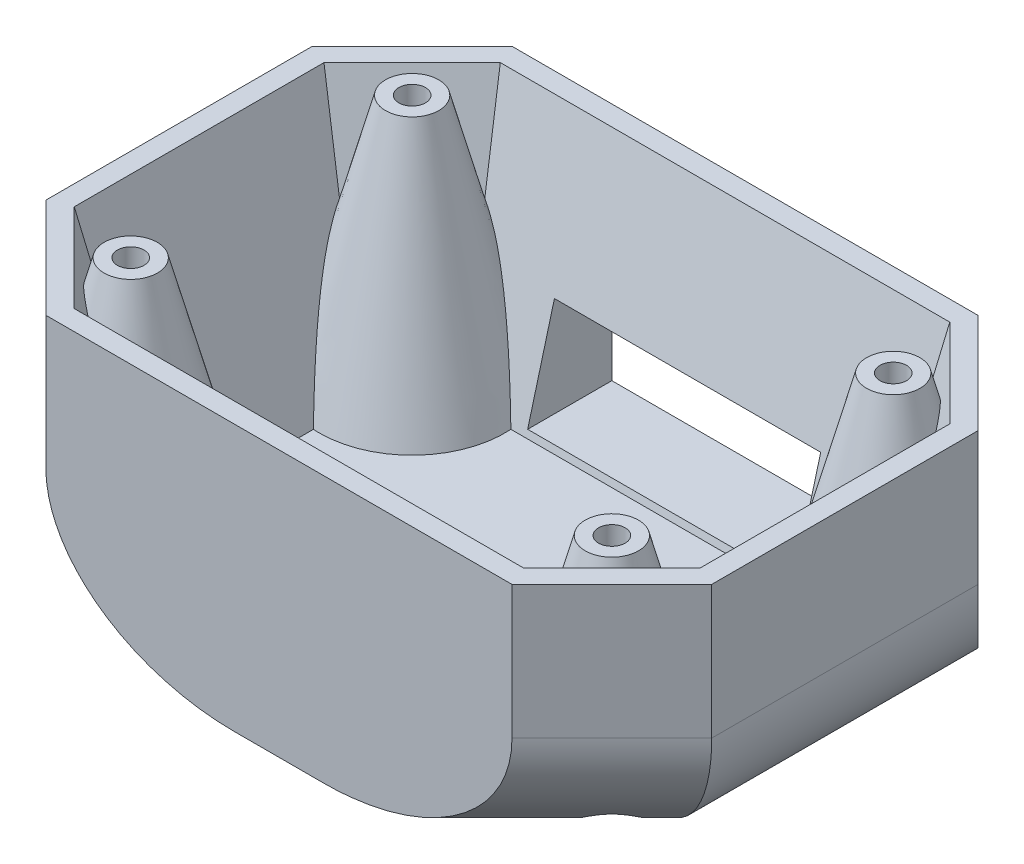
from build123d import *

# Parameters (mm, degrees)
BOSS_EXTRUDE1_DEPTH = 50.8
FILLET1_R           = 25.4
SKETCH2_R           = 5.08
CUT_EXTRUDE8_DEPTH  = 46.99
CUT_EXTRUDE8_TAPER  = 15
SKETCH2_5_R         = 2.54
CUT_EXTRUDE10_DEPTH = 25.4
SKETCH4_R           = 4.445
CUT_EXTRUDE11_DEPTH = 25.4
CUT_EXTRUDE12_REACH = 165.134
SKETCH5_W           = 50.8
SKETCH5_H           = 19.05


with BuildPart() as part:
    # Sketch1 → Boss-Extrude1 (new body)
    with BuildSketch(Plane(origin=(0, 0, 0), x_dir=(1, 0, 0), z_dir=(0, 1, 0))):
        Polygon((107.95, 88.9), (19.05, 88.9), (0, 69.85), (0, 19.05), (19.05, 0), (107.95, 0), (127, 19.05), (127, 69.85), align=None)
    extrude(amount=BOSS_EXTRUDE1_DEPTH)

    # Fillet1
    fillet1_edges = [part.edges().sort_by_distance(p)[0] for p in [
        (0, 0, -44.45),
        (9.525, 0, -9.525),
        (117.475, 0, -9.525),
        (127, 0, -44.45),
    ]]
    fillet(fillet1_edges, radius=FILLET1_R)

    # Sketch2 → Cut-Extrude8 (cut)
    with BuildSketch(Plane(origin=(0, 50.8, 0), x_dir=(1, 0, 0), z_dir=(0, 1, 0))):
        Polygon((123.19, 68.271846327), (106.371846327, 85.09), (20.628153673, 85.09), (3.81, 68.271846327), (3.81, 20.628153673), (20.628153673, 3.81), (106.371846327, 3.81), (123.19, 20.628153673), align=None)
        with Locations((17.607230509, 17.607230509)):
            Circle(SKETCH2_R, mode=Mode.SUBTRACT)
        with Locations((109.392769491, 17.607230509)):
            Circle(SKETCH2_R, mode=Mode.SUBTRACT)
        with Locations((17.607230509, 71.292769491)):
            Circle(SKETCH2_R, mode=Mode.SUBTRACT)
        with Locations((109.392769491, 71.292769491)):
            Circle(SKETCH2_R, mode=Mode.SUBTRACT)
    extrude(amount=-CUT_EXTRUDE8_DEPTH, taper=CUT_EXTRUDE8_TAPER, mode=Mode.SUBTRACT)

    # Sketch2<5> → Cut-Extrude10 (cut)
    with BuildSketch(Plane(origin=(0, 50.8, 0), x_dir=(1, 0, 0), z_dir=(0, 1, 0))):
        with Locations((17.607230509, 71.292769491)):
            Circle(SKETCH2_5_R)
        with Locations((17.607230509, 17.607230509)):
            Circle(SKETCH2_5_R)
        with Locations((109.392769491, 17.607230509)):
            Circle(SKETCH2_5_R)
        with Locations((109.392769491, 71.292769491)):
            Circle(SKETCH2_5_R)
    extrude(amount=-CUT_EXTRUDE10_DEPTH, mode=Mode.SUBTRACT)

    # Sketch4 → Cut-Extrude11 (cut)
    with BuildSketch(Plane(origin=(0, 25.4, 0), x_dir=(-1, 0, 0), z_dir=(0, -1, 0))):
        with Locations((-109.392769491, 71.292769491)):
            Circle(SKETCH4_R)
        with Locations((-109.392769491, 17.607230509)):
            Circle(SKETCH4_R)
        with Locations((-17.607230509, 17.607230509)):
            Circle(SKETCH4_R)
        with Locations((-17.607230509, 71.292769491)):
            Circle(SKETCH4_R)
    extrude(amount=CUT_EXTRUDE11_DEPTH, mode=Mode.SUBTRACT)

    # Sketch5 → Cut-Extrude12 (cut, up to next)
    with BuildSketch(Plane(origin=(0, 0, -88.9), x_dir=(-1, 0, 0), z_dir=(0, 0, -1)), mode=Mode.PRIVATE) as cut_extrude12_sk1:
        with Locations((-63.5, 14.605)):
            Rectangle(SKETCH5_W, SKETCH5_H)
    cut_extrude12_tool1 = extrude(cut_extrude12_sk1.sketch, amount=-CUT_EXTRUDE12_REACH, mode=Mode.PRIVATE) & part.part
    add(cut_extrude12_tool1.solids().sort_by_distance((63.5, 14.605, -88.9))[0], mode=Mode.SUBTRACT)


solid = part.part
